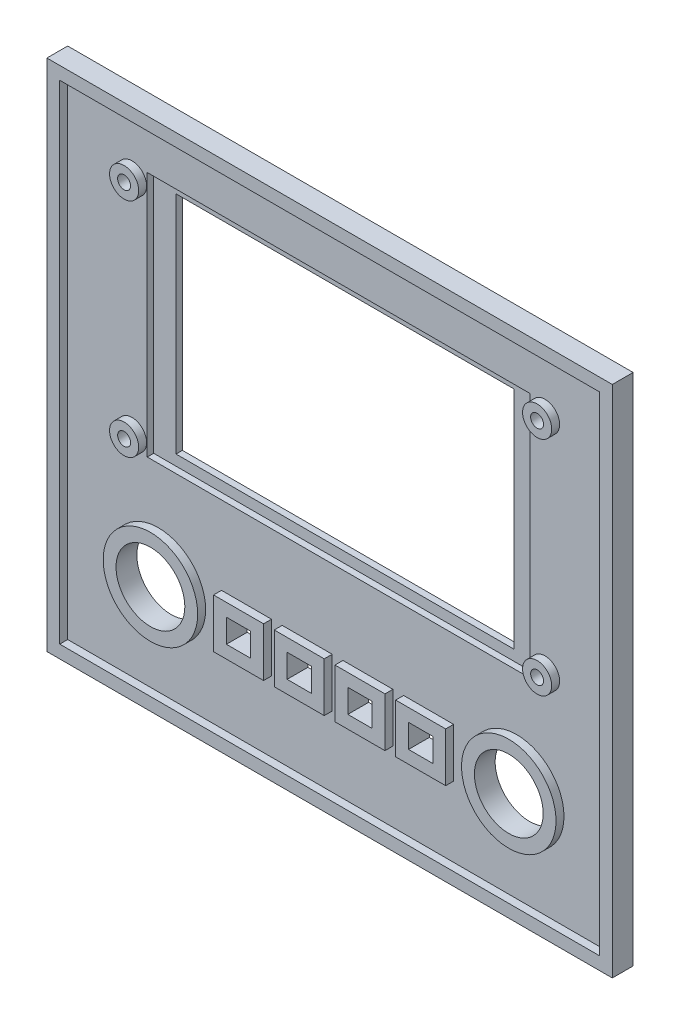
from build123d import *

# Parameters (mm, degrees)
SKETCH1_W           = 139.7
SKETCH1_H           = 127
SKETCH1_R           = 8.5
SKETCH1_W_2         = 6
SKETCH1_H_2         = 5.8
SKETCH1_W_3         = 83.52
SKETCH1_H_3         = 55.68
BOSS_EXTRUDE1_DEPTH = 5.1375
SKETCH2_W           = 94.57
SKETCH2_H           = 60.88
SKETCH2_W_2         = 83.52
SKETCH2_H_2         = 55.68
CUT_EXTRUDE1_DEPTH  = 3.55
SKETCH3_R           = 1.6
SKETCH3_R_2         = 1.6002
CUT_EXTRUDE2_DEPTH  = 10
SKETCH4_W           = 133.35
SKETCH4_H           = 120.65
SKETCH4_R           = 3.6
SKETCH4_R_2         = 3.6002
SKETCH4_R_3         = 11.675
SKETCH4_W_2         = 12.35
SKETCH4_H_2         = 12.15
SKETCH4_W_3         = 94.57
SKETCH4_H_3         = 60.88
CUT_EXTRUDE3_DEPTH  = 1.9625


with BuildPart() as part:
    # Sketch1 → Boss-Extrude1 (new body)
    with BuildSketch(Plane.XY):
        with Locations((-0.265452364, -19.000597583)):
            Rectangle(SKETCH1_W, SKETCH1_H)
        with Locations((44.004207636, -55.869967583)):
            Circle(SKETCH1_R, mode=Mode.SUBTRACT)
        with Locations((-44.535112364, -55.869967583)):
            Circle(SKETCH1_R, mode=Mode.SUBTRACT)
        with Locations((-7.765452364, -55.869967583)):
            Rectangle(SKETCH1_W_2, SKETCH1_H_2, mode=Mode.SUBTRACT)
        Rectangle(SKETCH1_W_3, SKETCH1_H_3, mode=Mode.SUBTRACT)
        with Locations((-22.765452364, -55.869967583)):
            Rectangle(SKETCH1_W_2, SKETCH1_H_2, mode=Mode.SUBTRACT)
        with Locations((7.234547636, -55.869967583)):
            Rectangle(SKETCH1_W_2, SKETCH1_H_2, mode=Mode.SUBTRACT)
        with Locations((22.234547636, -55.869967583)):
            Rectangle(SKETCH1_W_2, SKETCH1_H_2, mode=Mode.SUBTRACT)
    extrude(amount=BOSS_EXTRUDE1_DEPTH)

    # Sketch2 → Cut-Extrude1 (cut)
    with BuildSketch(Plane.XY.offset(5.1375)):
        Rectangle(SKETCH2_W, SKETCH2_H)
        Rectangle(SKETCH2_W_2, SKETCH2_H_2, mode=Mode.SUBTRACT)
    extrude(amount=-CUT_EXTRUDE1_DEPTH, mode=Mode.SUBTRACT)

    # Sketch3 → Cut-Extrude2 (cut)
    with BuildSketch(Plane.XY.offset(5.1375)):
        with Locations((51.005027636, -27.450347583)):
            Circle(SKETCH3_R)
        with Locations((-51.034972364, 27.449652417)):
            Circle(SKETCH3_R)
        with Locations((51.005027636, 27.449652417)):
            Circle(SKETCH3_R)
        with Locations((-51.034972364, -27.449907583)):
            Circle(SKETCH3_R_2)
    extrude(amount=-CUT_EXTRUDE2_DEPTH, mode=Mode.SUBTRACT)

    # Sketch4 → Cut-Extrude3 (cut)
    with BuildSketch(Plane.XY.offset(5.1375)):
        with Locations((-0.265452364, -19.000597583)):
            Rectangle(SKETCH4_W, SKETCH4_H)
        with Locations((51.005027636, -27.450347583)):
            Circle(SKETCH4_R, mode=Mode.SUBTRACT)
        with Locations((-51.034972364, -27.449907583)):
            Circle(SKETCH4_R_2, mode=Mode.SUBTRACT)
        with Locations((-51.034972364, 27.449652417)):
            Circle(SKETCH4_R, mode=Mode.SUBTRACT)
        with Locations((51.005027636, 27.449652417)):
            Circle(SKETCH4_R, mode=Mode.SUBTRACT)
        with Locations((-44.535112364, -55.869967583)):
            Circle(SKETCH4_R_3, mode=Mode.SUBTRACT)
        with Locations((44.004207636, -55.869967583)):
            Circle(SKETCH4_R_3, mode=Mode.SUBTRACT)
        with Locations((22.234547636, -55.869967583)):
            Rectangle(SKETCH4_W_2, SKETCH4_H_2, mode=Mode.SUBTRACT)
        with Locations((-7.765452364, -55.869967583)):
            Rectangle(SKETCH4_W_2, SKETCH4_H_2, mode=Mode.SUBTRACT)
        with Locations((-22.765452364, -55.869967583)):
            Rectangle(SKETCH4_W_2, SKETCH4_H_2, mode=Mode.SUBTRACT)
        with Locations((7.234547636, -55.869967583)):
            Rectangle(SKETCH4_W_2, SKETCH4_H_2, mode=Mode.SUBTRACT)
        Rectangle(SKETCH4_W_3, SKETCH4_H_3, mode=Mode.SUBTRACT)
    extrude(amount=-CUT_EXTRUDE3_DEPTH, mode=Mode.SUBTRACT)


solid = part.part
